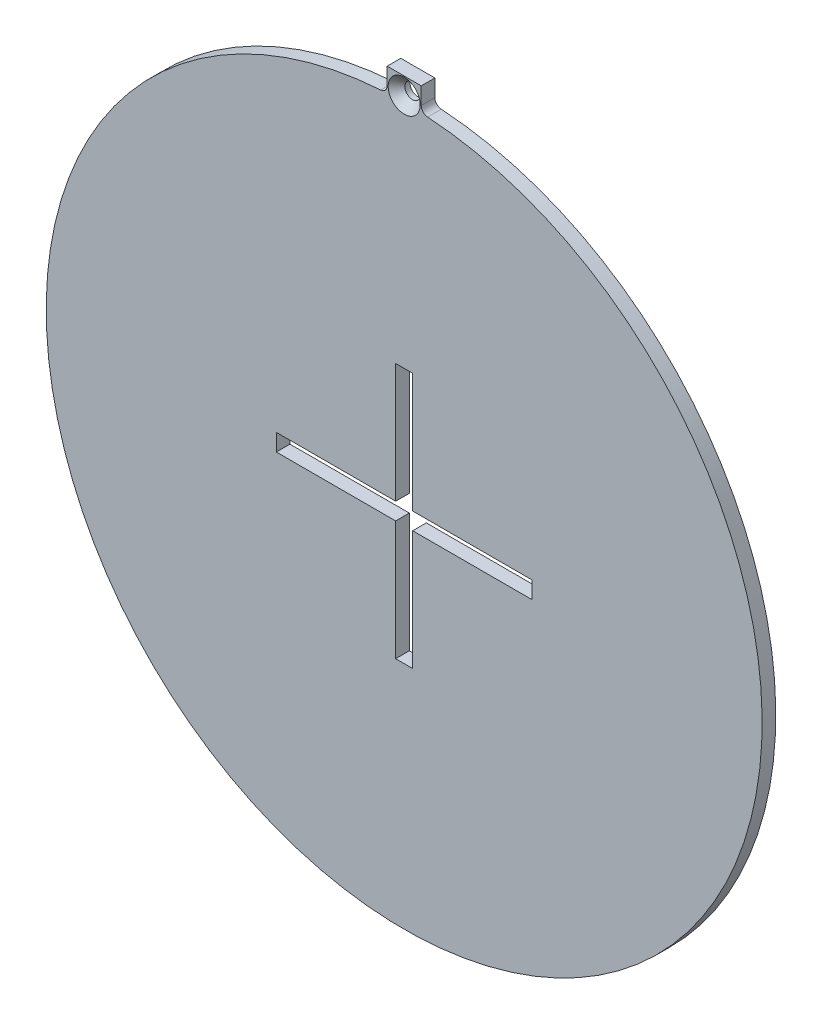
from build123d import *

# Parameters (mm, degrees)
BOSS_EXTRUDE1_DEPTH = 4
CUT_EXTRUDE1_REACH  = 155.407


with BuildPart() as part:
    # Sketch1 → Boss-Extrude1 (new body)
    with BuildSketch(Plane.XY):
        with BuildLine():
            Line((5, 106.77078252), (5, 111.77078252))
            Line((5, 111.77078252), (-5, 111.77078252))
            Line((-5, 111.77078252), (-5, 106.77078252))
            ThreePointArc((-5, 106.77078252), (-5.540259913, 105.403610666), (-6.869158879, 104.775066959))
            ThreePointArc((-6.869158879, 104.775066959), (0, -105), (6.869158879, 104.775066959))
            ThreePointArc((6.869158879, 104.775066959), (5.540259913, 105.403610666), (5, 106.77078252))
        make_face()
    extrude(amount=BOSS_EXTRUDE1_DEPTH)

    # Sketch2 → Cut-Extrude1 (cut, up to next)
    with BuildSketch(Plane(origin=(0, 0, 0), x_dir=(-1, 0, 0), z_dir=(0, 0, -1)), mode=Mode.PRIVATE) as cut_extrude1_sk1:
        Polygon((-2.5, -2.5), (-2.5, -37.5), (2.5, -37.5), (2.5, -2.5), (37.5, -2.5), (37.5, 2.5), (2.5, 2.5), (2.5, 37.5), (-2.5, 37.5), (-2.5, 2.5), (-37.5, 2.5), (-37.5, -2.5), align=None)
    cut_extrude1_tool1 = extrude(cut_extrude1_sk1.sketch, amount=-CUT_EXTRUDE1_REACH, mode=Mode.PRIVATE) & part.part
    add(cut_extrude1_tool1.solids().sort_by_distance((0, 0, 0))[0], mode=Mode.SUBTRACT)

    # Sketch3 → CSK for M4 Countersunk Flat Head Screw1 (revolve, cut)
    with BuildSketch(Plane(origin=(0, 106.77078252, 4), x_dir=(0, -1, 0), z_dir=(1, 0, 0))):
        Polygon((0, 0), (0, 4), (2.25, 4), (2.25, 2.45), (4.7, 0), align=None)
    revolve(axis=Axis((0, 106.77078252, 10.35), (0, 0, -1)), mode=Mode.SUBTRACT)


solid = part.part
